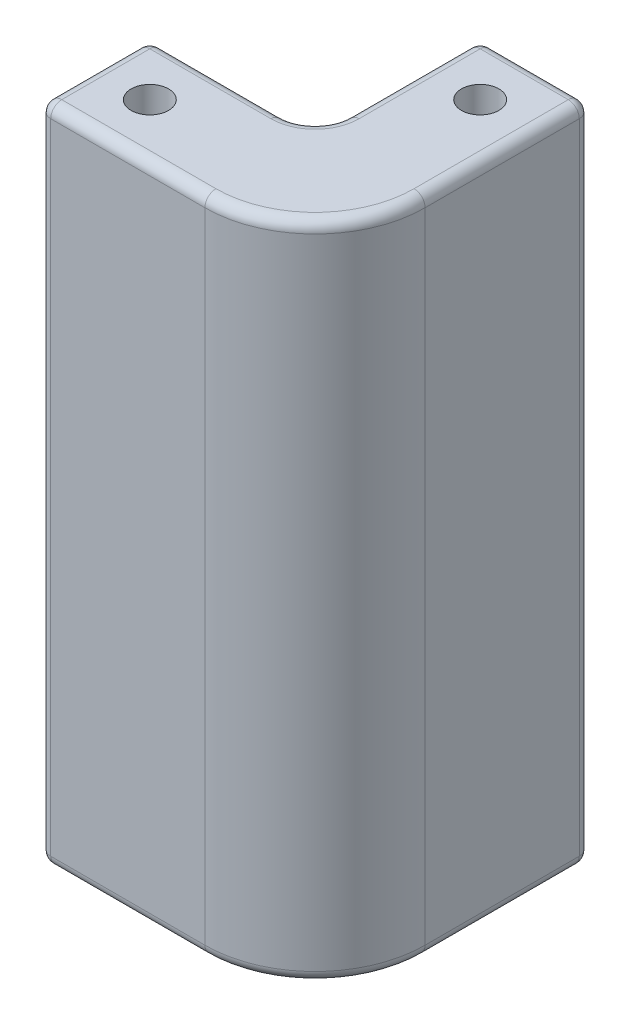
from build123d import *

# Parameters (mm, degrees)
SKETCH1_W           = 15
SKETCH1_H           = 10
SKETCH1_R           = 1.7
SKETCH1_W_2         = 10
SKETCH1_H_2         = 15
BOSS_EXTRUDE1_DEPTH = 60
SKETCH2_W           = 5.8
SKETCH2_H           = 2.6
CUT_EXTRUDE1_DEPTH  = 9
SKETCH3_W           = 5.8
SKETCH3_H           = 2.6
CUT_EXTRUDE2_DEPTH  = 9
FILLET1_R           = 1
FILLET3_R           = 3
FILLET4_R           = 1


with BuildPart() as part:
    # Sketch1 → Boss-Extrude1 (new body)
    # profile 1 of 3: a face of its own
    with BuildSketch(Plane(origin=(0, 0, 0), x_dir=(1, 0, 0), z_dir=(0, 1, 0))):
        with Locations((-7.5, -5)):
            Rectangle(SKETCH1_W, SKETCH1_H)
        with Locations(Location((-10, -5, 0), (0, 0, 270))):
            Circle(SKETCH1_R, mode=Mode.SUBTRACT)
    # profile 2 of 3: a face of its own
    with BuildSketch(Plane(origin=(0, 0, 0), x_dir=(1, 0, 0), z_dir=(0, 1, 0))):
        with BuildLine():
            ThreePointArc((10, 0), (7.071067812, -7.071067812), (0, -10))
            Line((0, -10), (0, 0))
            Line((0, 0), (10, 0))
        make_face()
    # profile 3 of 3: a face of its own
    with BuildSketch(Plane(origin=(0, 0, 0), x_dir=(1, 0, 0), z_dir=(0, 1, 0))):
        with Locations((5, 7.5)):
            Rectangle(SKETCH1_W_2, SKETCH1_H_2)
        with Locations(Location((5, 10, 0), (0, 0, 270))):
            Circle(SKETCH1_R, mode=Mode.SUBTRACT)
    extrude(amount=BOSS_EXTRUDE1_DEPTH)

    # Sketch2 → Cut-Extrude1 (cut)
    with BuildSketch(Plane.ZY):
        with Locations((-10, 55)):
            Rectangle(SKETCH2_W, SKETCH2_H)
        with Locations((-10, 5)):
            Rectangle(SKETCH2_W, SKETCH2_H)
    extrude(amount=-CUT_EXTRUDE1_DEPTH, mode=Mode.SUBTRACT)

    # Sketch3 → Cut-Extrude2 (cut)
    with BuildSketch(Plane(origin=(0, 0, 0), x_dir=(-1, 0, 0), z_dir=(0, 0, -1))):
        with Locations((10, 55)):
            Rectangle(SKETCH3_W, SKETCH3_H)
        with Locations((10, 5)):
            Rectangle(SKETCH3_W, SKETCH3_H)
    extrude(amount=-CUT_EXTRUDE2_DEPTH, mode=Mode.SUBTRACT)

    # Fillet1
    fillet1_edges = [part.edges().sort_by_distance(p)[0] for p in [
        (0, 30, -15),
        (10, 30, -15),
        (-15, 30, 10),
        (-15, 30, 0),
    ]]
    fillet(fillet1_edges, radius=FILLET1_R)

    # Fillet3
    fillet3_edges = [part.edges().sort_by_distance(p)[0] for p in [
        (0, 30, 0),
    ]]
    fillet(fillet3_edges, radius=FILLET3_R)

    # Fillet4
    fillet4_edges = [part.edges().sort_by_distance(p)[0] for p in [
        (10, 0, -7),
        (5, 0, -15),
        (-15, 0, 5),
        (9.707106781, 0, -14.707106781),
        (0.292893219, 0, -14.707106781),
        (-14.707106781, 0, 0.292893219),
        (7.071067812, 0, 7.071067812),
        (-14.707106781, 0, 9.707106781),
        (-15, 60, 5),
        (5, 60, -15),
        (9.707106781, 60, -14.707106781),
        (-7, 0, 10),
        (0.292893219, 60, -14.707106781),
        (-14.707106781, 60, 0.292893219),
        (-14.707106781, 60, 9.707106781),
        (-8.5, 0, 0),
        (-8.5, 60, 0),
        (0, 60, -8.5),
        (0, 0, -8.5),
        (-0.878679656, 0, -0.878679656),
        (-0.878679656, 60, -0.878679656),
        (-7, 60, 10),
        (7.071067812, 60, 7.071067812),
        (10, 60, -7),
    ]]
    fillet(fillet4_edges, radius=FILLET4_R)


solid = part.part
